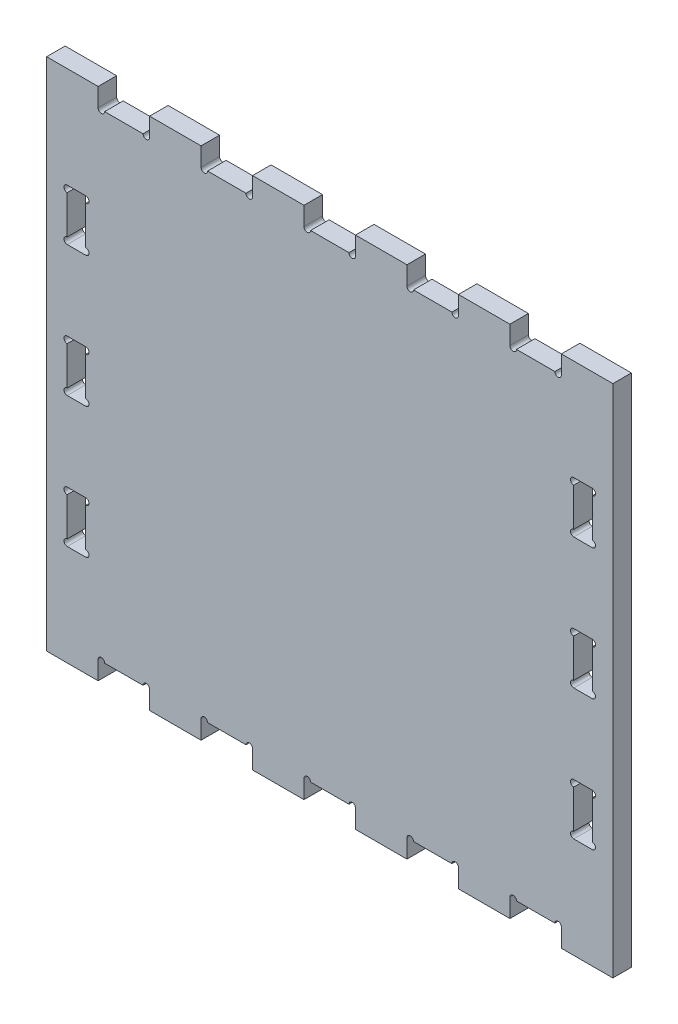
from build123d import *

# Parameters (mm, degrees)
ESTRUSIONE_ESTRUSIONE1_DEPTH = 18
TAGLIO_ESTRUSIONE1_DEPTH     = 115
TAGLIO_ESTRUSIONE2_DEPTH     = 258
TAGLIO_ESTRUSIONE3_DEPTH     = 723
TAGLIO_ESTRUSIONE4_DEPTH     = 160
TAGLIO_ESTRUSIONE5_DEPTH     = 190
TAGLIO_ESTRUSIONE6_DEPTH     = 231


with BuildPart() as part:
    # Schizzo2 → Estrusione-Estrusione1 (new body)
    with BuildSketch(Plane.XY):
        with BuildLine():
            Line((-275, -250), (-275, 250))
            Line((-275, 250), (-225, 250))
            Line((-225, 250), (-225, 232))
            ThreePointArc((-225, 232), (-221.825, 228.825), (-218.65, 232))
            Line((-218.65, 232), (-181.35, 232))
            ThreePointArc((-181.35, 232), (-178.175, 228.825), (-175, 232))
            Line((-175, 232), (-175, 250))
            Line((-175, 250), (-125, 250))
            Line((-125, 250), (-125, 232))
            ThreePointArc((-125, 232), (-121.825, 228.825), (-118.65, 232))
            Line((-118.65, 232), (-81.35, 232))
            ThreePointArc((-81.35, 232), (-78.175, 228.825), (-75, 232))
            Line((-75, 232), (-75, 250))
            Line((-75, 250), (-25, 250))
            Line((-25, 250), (-25, 232))
            ThreePointArc((-25, 232), (-21.825, 228.825), (-18.65, 232))
            Line((-18.65, 232), (18.65, 232))
            ThreePointArc((18.65, 232), (21.825, 228.825), (25, 232))
            Line((25, 232), (25, 250))
            Line((25, 250), (75, 250))
            Line((75, 250), (75, 232))
            ThreePointArc((75, 232), (78.175, 228.825), (81.35, 232))
            Line((81.35, 232), (118.65, 232))
            ThreePointArc((118.65, 232), (121.825, 228.825), (125, 232))
            Line((125, 232), (125, 250))
            Line((125, 250), (175, 250))
            Line((175, 250), (175, 232))
            ThreePointArc((175, 232), (178.175, 228.825), (181.35, 232))
            Line((181.35, 232), (218.65, 232))
            ThreePointArc((218.65, 232), (221.825, 228.825), (225, 232))
            Line((225, 232), (225, 250))
            Line((225, 250), (275, 250))
            Line((275, 250), (275, -250))
            Line((275, -250), (225, -250))
            Line((225, -250), (225, -232))
            ThreePointArc((225, -232), (221.825, -228.825), (218.65, -232))
            Line((218.65, -232), (181.35, -232))
            ThreePointArc((181.35, -232), (178.175, -228.825), (175, -232))
            Line((175, -232), (175, -250))
            Line((175, -250), (125, -250))
            Line((125, -250), (125, -232))
            ThreePointArc((125, -232), (121.825, -228.825), (118.65, -232))
            Line((118.65, -232), (81.35, -232))
            ThreePointArc((81.35, -232), (78.175, -228.825), (75, -232))
            Line((75, -232), (75, -250))
            Line((75, -250), (25, -250))
            Line((25, -250), (25, -232))
            ThreePointArc((25, -232), (21.825, -228.825), (18.65, -232))
            Line((18.65, -232), (-18.65, -232))
            ThreePointArc((-18.65, -232), (-21.825, -228.825), (-25, -232))
            Line((-25, -232), (-25, -250))
            Line((-25, -250), (-75, -250))
            Line((-75, -250), (-75, -232))
            ThreePointArc((-75, -232), (-78.175, -228.825), (-81.35, -232))
            Line((-81.35, -232), (-118.65, -232))
            ThreePointArc((-118.65, -232), (-121.825, -228.825), (-125, -232))
            Line((-125, -232), (-125, -250))
            Line((-125, -250), (-175, -250))
            Line((-175, -250), (-175, -232))
            ThreePointArc((-175, -232), (-178.175, -228.825), (-181.35, -232))
            Line((-181.35, -232), (-218.65, -232))
            ThreePointArc((-218.65, -232), (-221.825, -228.825), (-225, -232))
            Line((-225, -232), (-225, -250))
            Line((-225, -250), (-275, -250))
        make_face()
    extrude(amount=ESTRUSIONE_ESTRUSIONE1_DEPTH)

    # Schizzo2<4> → Taglio-Estrusione1 (cut)
    with BuildSketch(Plane.XY):
        with BuildLine():
            Line((237, 145.65), (237, 108.35))
            ThreePointArc((237, 108.35), (233.825, 105.175), (237, 102))
            Line((237, 102), (255, 102))
            ThreePointArc((255, 102), (258.175, 105.175), (255, 108.35))
            Line((255, 108.35), (255, 145.65))
            ThreePointArc((255, 145.65), (258.175, 148.825), (255, 152))
            Line((255, 152), (237, 152))
            ThreePointArc((237, 152), (233.825, 148.825), (237, 145.65))
        make_face()
    extrude(amount=TAGLIO_ESTRUSIONE1_DEPTH, mode=Mode.SUBTRACT)

    # Schizzo2<5> → Taglio-Estrusione2 (cut)
    with BuildSketch(Plane.XY):
        with BuildLine():
            Line((255, -18.65), (255, 18.65))
            ThreePointArc((255, 18.65), (258.175, 21.825), (255, 25))
            Line((255, 25), (237, 25))
            ThreePointArc((237, 25), (233.825, 21.825), (237, 18.65))
            Line((237, 18.65), (237, -18.65))
            ThreePointArc((237, -18.65), (233.825, -21.825), (237, -25))
            Line((237, -25), (255, -25))
            ThreePointArc((255, -25), (258.175, -21.825), (255, -18.65))
        make_face()
    extrude(amount=TAGLIO_ESTRUSIONE2_DEPTH, mode=Mode.SUBTRACT)

    # Schizzo2<7> → Taglio-Estrusione3 (cut)
    with BuildSketch(Plane.XY):
        with BuildLine():
            Line((255, -152), (237, -152))
            ThreePointArc((237, -152), (233.825, -148.825), (237, -145.65))
            Line((237, -145.65), (237, -108.35))
            ThreePointArc((237, -108.35), (233.825, -105.175), (237, -102))
            Line((237, -102), (255, -102))
            ThreePointArc((255, -102), (258.175, -105.175), (255, -108.35))
            Line((255, -108.35), (255, -145.65))
            ThreePointArc((255, -145.65), (258.175, -148.825), (255, -152))
        make_face()
    extrude(amount=TAGLIO_ESTRUSIONE3_DEPTH, mode=Mode.SUBTRACT)

    # Schizzo2<8> → Taglio-Estrusione4 (cut)
    with BuildSketch(Plane.XY):
        with BuildLine():
            Line((-255, 152), (-237, 152))
            ThreePointArc((-237, 152), (-233.825, 148.825), (-237, 145.65))
            Line((-237, 145.65), (-237, 108.35))
            ThreePointArc((-237, 108.35), (-233.825, 105.175), (-237, 102))
            Line((-237, 102), (-255, 102))
            ThreePointArc((-255, 102), (-258.175, 105.175), (-255, 108.35))
            Line((-255, 108.35), (-255, 145.65))
            ThreePointArc((-255, 145.65), (-258.175, 148.825), (-255, 152))
        make_face()
    extrude(amount=TAGLIO_ESTRUSIONE4_DEPTH, mode=Mode.SUBTRACT)

    # Schizzo2<9> → Taglio-Estrusione5 (cut)
    with BuildSketch(Plane.XY):
        with BuildLine():
            Line((-255, 25), (-237, 25))
            ThreePointArc((-237, 25), (-233.825, 21.825), (-237, 18.65))
            Line((-237, 18.65), (-237, -18.65))
            ThreePointArc((-237, -18.65), (-233.825, -21.825), (-237, -25))
            Line((-237, -25), (-255, -25))
            ThreePointArc((-255, -25), (-258.175, -21.825), (-255, -18.65))
            Line((-255, -18.65), (-255, 18.65))
            ThreePointArc((-255, 18.65), (-258.175, 21.825), (-255, 25))
        make_face()
    extrude(amount=TAGLIO_ESTRUSIONE5_DEPTH, mode=Mode.SUBTRACT)

    # Schizzo2<10> → Taglio-Estrusione6 (cut)
    with BuildSketch(Plane.XY):
        with BuildLine():
            Line((-237, -145.65), (-237, -108.35))
            ThreePointArc((-237, -108.35), (-233.825, -105.175), (-237, -102))
            Line((-237, -102), (-255, -102))
            ThreePointArc((-255, -102), (-258.175, -105.175), (-255, -108.35))
            Line((-255, -108.35), (-255, -145.65))
            ThreePointArc((-255, -145.65), (-258.175, -148.825), (-255, -152))
            Line((-255, -152), (-237, -152))
            ThreePointArc((-237, -152), (-233.825, -148.825), (-237, -145.65))
        make_face()
    extrude(amount=TAGLIO_ESTRUSIONE6_DEPTH, mode=Mode.SUBTRACT)


solid = part.part
